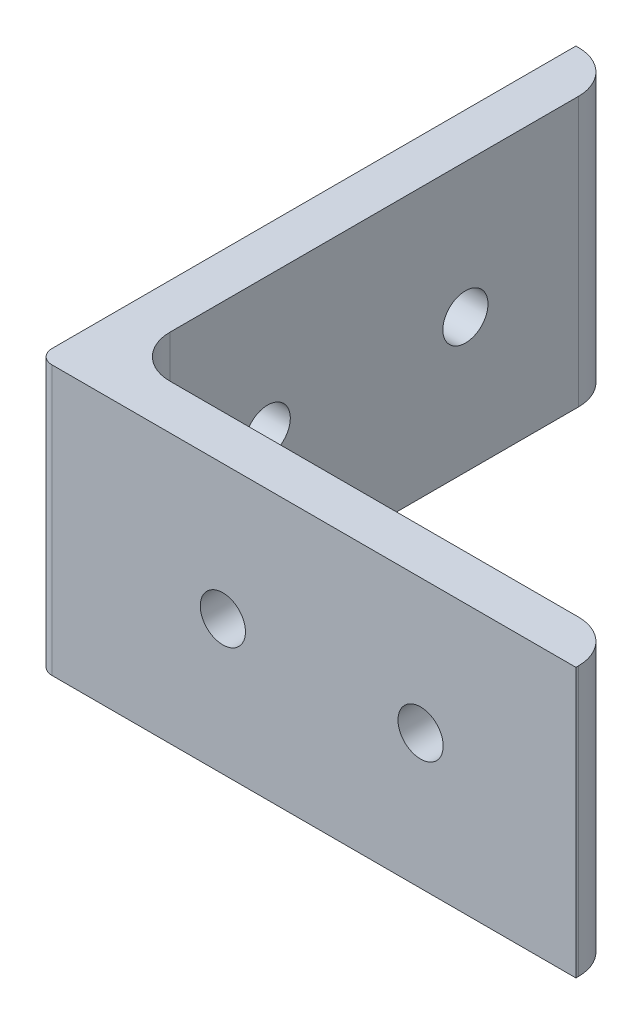
from build123d import *

# Parameters (mm, degrees)
BOSS_EXTRUDE1_DEPTH = 19.05
FILLET1_R           = 3
FILLET2_R           = 1
SKETCH2_R           = 1.6
CUT_EXTRUDE1_DEPTH  = 58.15
SKETCH3_R           = 1.6
CUT_EXTRUDE2_DEPTH  = 58.15


with BuildPart() as part:
    # Sketch1 → Boss-Extrude1 (new body)
    with BuildSketch(Plane(origin=(0, 0, 0), x_dir=(1, 0, 0), z_dir=(0, 1, 0))):
        Polygon((0, 0), (0, 38.1), (3.175, 38.1), (3.175, 3.175), (38.1, 3.175), (38.1, 0), align=None)
    extrude(amount=BOSS_EXTRUDE1_DEPTH)

    # Fillet1
    fillet1_edges = [part.edges().sort_by_distance(p)[0] for p in [
        (3.175, 9.525, -38.1),
        (3.175, 9.525, -3.175),
        (38.1, 9.525, -3.175),
    ]]
    fillet(fillet1_edges, radius=FILLET1_R)

    # Fillet2
    fillet2_edges = [part.edges().sort_by_distance(p)[0] for p in [
        (0, 9.525, 0),
    ]]
    fillet(fillet2_edges, radius=FILLET2_R)

    # Sketch2 → Cut-Extrude1 (cut, through all)
    with BuildSketch(Plane.XY):
        with Locations((13.1, 9.525)):
            Circle(SKETCH2_R)
        with Locations((27.1, 9.525)):
            Circle(SKETCH2_R)
    extrude(amount=-CUT_EXTRUDE1_DEPTH, mode=Mode.SUBTRACT)

    # Sketch3 → Cut-Extrude2 (cut, through all)
    with BuildSketch(Plane.ZY):
        with Locations((-27.1, 9.525)):
            Circle(SKETCH3_R)
        with Locations((-13.1, 9.525)):
            Circle(SKETCH3_R)
    extrude(amount=-CUT_EXTRUDE2_DEPTH, mode=Mode.SUBTRACT)


solid = part.part
